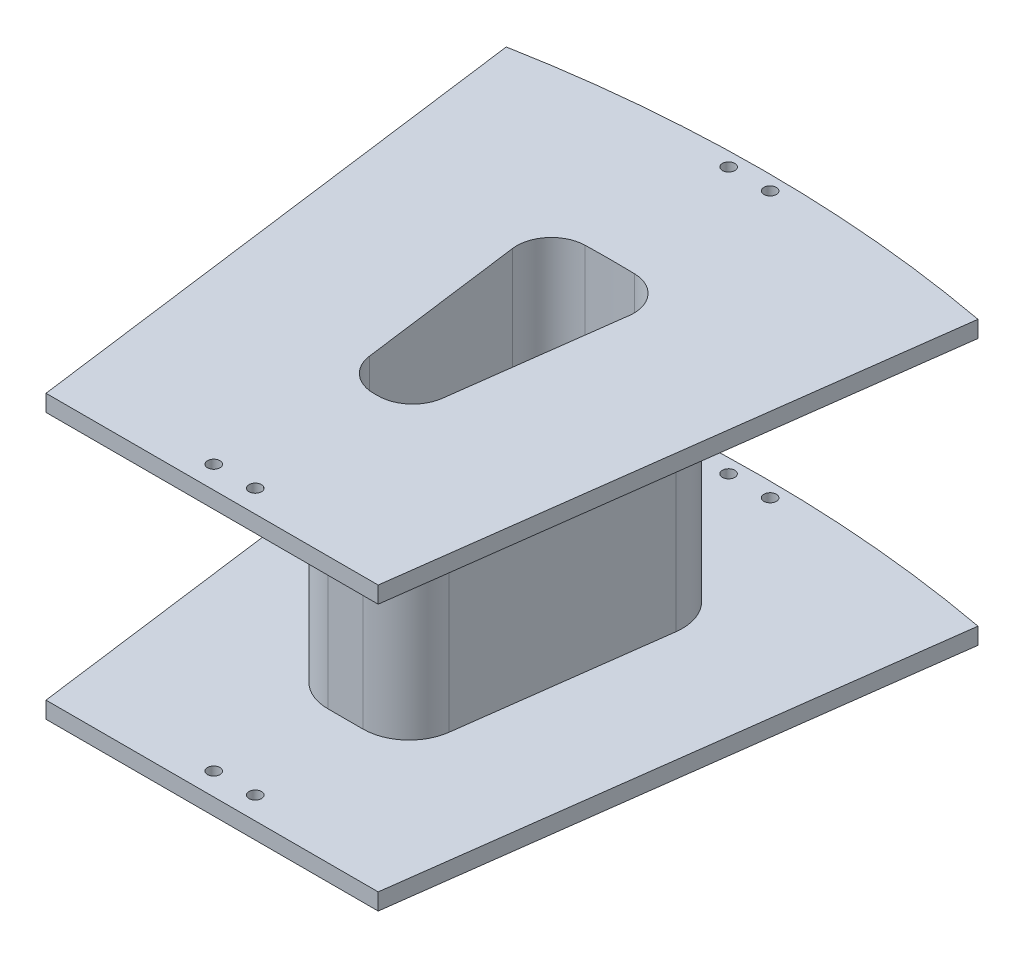
from build123d import *

# Parameters (mm, degrees)
SKETCH1_R           = 1.5
BOSS_EXTRUDE1_DEPTH = 4
BOSS_EXTRUDE2_DEPTH = 60
SCALE1_SCALE        = 0.27
FILLET1_R           = 3
CUT_EXTRUDE1_DEPTH  = 20


with BuildPart() as part:
    # Sketch1 → Boss-Extrude1 (new body)
    with BuildSketch(Plane(origin=(0, 0, 0), x_dir=(1, 0, 0), z_dir=(0, 1, 0))):
        with BuildLine():
            Line((-56.806235592, 60.259400507), (-40, -67.396632609))
            Line((-40, -67.396632609), (40, -67.396632609))
            Line((40, -67.396632609), (56.806235592, 60.259400507))
            ThreePointArc((56.806235592, 60.259400507), (0, 65.5), (-56.806235592, 60.259400507))
        make_face()
        with Locations(Location((-5, 62, 0), (0, 0, 270))):
            Circle(SKETCH1_R, mode=Mode.SUBTRACT)
        with Locations(Location((-5, -62, 0), (0, 0, 270))):
            Circle(SKETCH1_R, mode=Mode.SUBTRACT)
        with Locations(Location((5, -62, 0), (0, 0, 90))):
            Circle(SKETCH1_R, mode=Mode.SUBTRACT)
        with Locations(Location((5, 62, 0), (0, 0, 90))):
            Circle(SKETCH1_R, mode=Mode.SUBTRACT)
    boss_extrude1 = extrude(amount=BOSS_EXTRUDE1_DEPTH)

    # Sketch2 → Boss-Extrude2 (add)
    with BuildSketch(Plane(origin=(0, 4, 0), x_dir=(1, 0, 0), z_dir=(0, 1, 0))):
        with BuildLine():
            Line((13.971014299, -35.267480529), (23.161620791, 34.542106528))
            ThreePointArc((23.161620791, 34.542106528), (0, 35.5), (-23.161620791, 34.542106528))
            Line((-23.161620791, 34.542106528), (-13.971014299, -35.267480529))
            Line((-13.971014299, -35.267480529), (13.971014299, -35.267480529))
        make_face()
    extrude(amount=BOSS_EXTRUDE2_DEPTH)

    # Mirror1: Boss-Extrude1 across plane
    add(boss_extrude1.mirror(Plane.ZX.offset(34)))


with BuildPart() as part_1:
    # Scale1: scaled about (0, 34, -2.563249607)
    add(part.part.scale(SCALE1_SCALE).moved(Location((0, 24.82, -1.871172213))))

    # Fillet1
    fillet1_edges = [part_1.edges().sort_by_distance(p)[0] for p in [
        (3.772173861, 34, 7.65104753),
        (6.253637614, 34, -11.197540976),
        (-6.253637614, 34, -11.197540976),
        (-3.772173861, 34, 7.65104753),
    ]]
    fillet(fillet1_edges, radius=FILLET1_R)

    # Sketch3 → Cut-Extrude1 (cut)
    with BuildSketch(Plane(origin=(0, 43.18, 0), x_dir=(1, 0, 0), z_dir=(0, 1, 0))):
        with BuildLine():
            ThreePointArc((2.373141134, -3.721290728), (1.624743129, -5.12027622), (0.139265082, -5.677604625))
            ThreePointArc((0.139265082, -5.677604625), (0, -5.677507909), (-0.139265082, -5.677604625))
            ThreePointArc((-0.139265082, -5.677604625), (-1.624743129, -5.12027622), (-2.373141134, -3.721290728))
            Line((-2.373141134, -3.721290728), (-3.784051042, 6.995634014))
            ThreePointArc((-3.784051042, 6.995634014), (-3.260936346, 8.754404452), (-1.602122137, 9.538788197))
            ThreePointArc((-1.602122137, 9.538788197), (0, 9.556172213), (1.602122137, 9.538788197))
            ThreePointArc((1.602122137, 9.538788197), (3.260936346, 8.754404452), (3.784051042, 6.995634014))
            Line((3.784051042, 6.995634014), (2.373141134, -3.721290728))
        make_face()
    extrude(amount=-CUT_EXTRUDE1_DEPTH, mode=Mode.SUBTRACT)


solid = part_1.part
